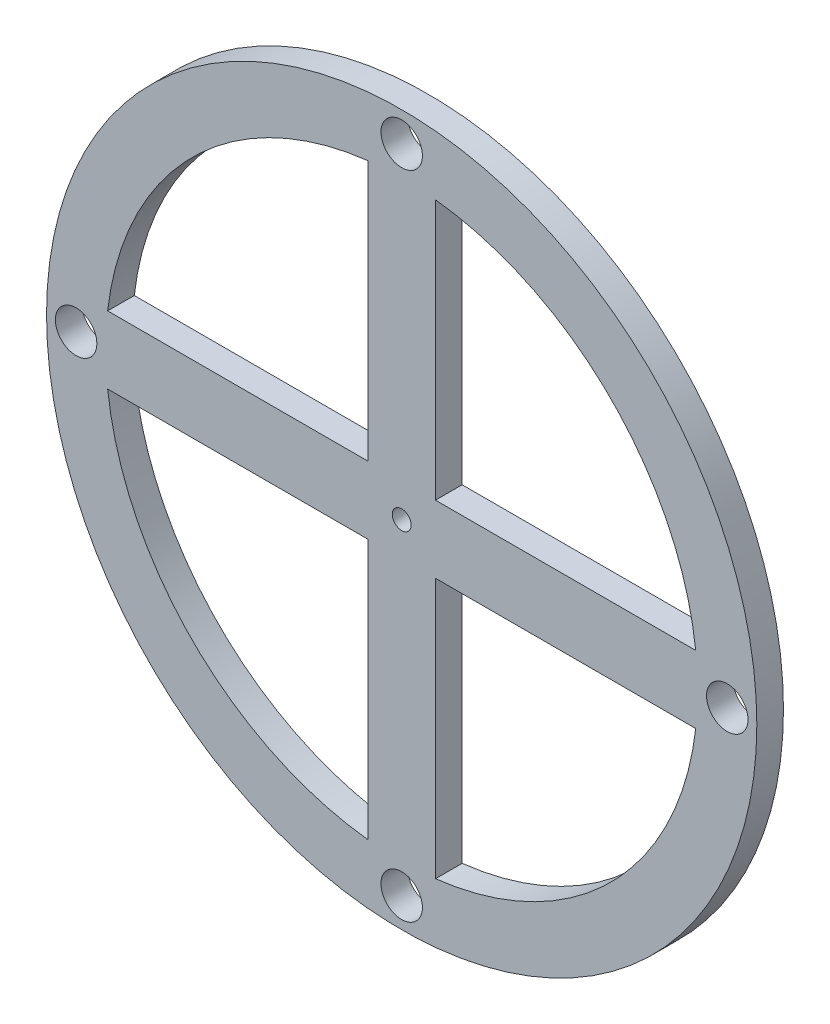
from build123d import *

# Parameters (mm, degrees)
ESQUISSE1_R        = 60
ESQUISSE1_R_2      = 3.5
ESQUISSE1_R_3      = 50
ESQUISSE1_R_4      = 1.595
BOSS_EXTRU_4_DEPTH = 4.5


with BuildPart() as part:
    # Esquisse1 → Boss.-Extru.4 (new body)
    # profile 1 of 2: a face of its own
    with BuildSketch(Plane.XY):
        Circle(ESQUISSE1_R)
        with Locations((-55, 0)):
            Circle(ESQUISSE1_R_2, mode=Mode.SUBTRACT)
        with Locations((55, 0)):
            Circle(ESQUISSE1_R_2, mode=Mode.SUBTRACT)
        with Locations((0, -55)):
            Circle(ESQUISSE1_R_2, mode=Mode.SUBTRACT)
        Circle(ESQUISSE1_R_3, mode=Mode.SUBTRACT)
        with Locations((0, 55)):
            Circle(ESQUISSE1_R_2, mode=Mode.SUBTRACT)
    # profile 2 of 2: a face of its own
    with BuildSketch(Plane.XY):
        with BuildLine():
            Line((5.714285714, 5.714285714), (5.714285714, 49.672396145))
            ThreePointArc((5.714285714, 49.672396145), (0, 50), (-5.714285714, 49.672396145))
            Line((-5.714285714, 49.672396145), (-5.714285714, 5.714285714))
            Line((-5.714285714, 5.714285714), (-49.672396145, 5.714285714))
            ThreePointArc((-49.672396145, 5.714285714), (-50, 0), (-49.672396145, -5.714285714))
            Line((-49.672396145, -5.714285714), (-5.714285714, -5.714285714))
            Line((-5.714285714, -5.714285714), (-5.714285714, -49.672396145))
            ThreePointArc((-5.714285714, -49.672396145), (0, -50), (5.714285714, -49.672396145))
            Line((5.714285714, -49.672396145), (5.714285714, -5.714285714))
            Line((5.714285714, -5.714285714), (49.672396145, -5.714285714))
            ThreePointArc((49.672396145, -5.714285714), (49.918031848, -2.861834443), (50, 0))
            ThreePointArc((50, 0), (49.918031848, 2.861834443), (49.672396145, 5.714285714))
            Line((49.672396145, 5.714285714), (5.714285714, 5.714285714))
        make_face()
        Circle(ESQUISSE1_R_4, mode=Mode.SUBTRACT)
    extrude(amount=BOSS_EXTRU_4_DEPTH)


solid = part.part
